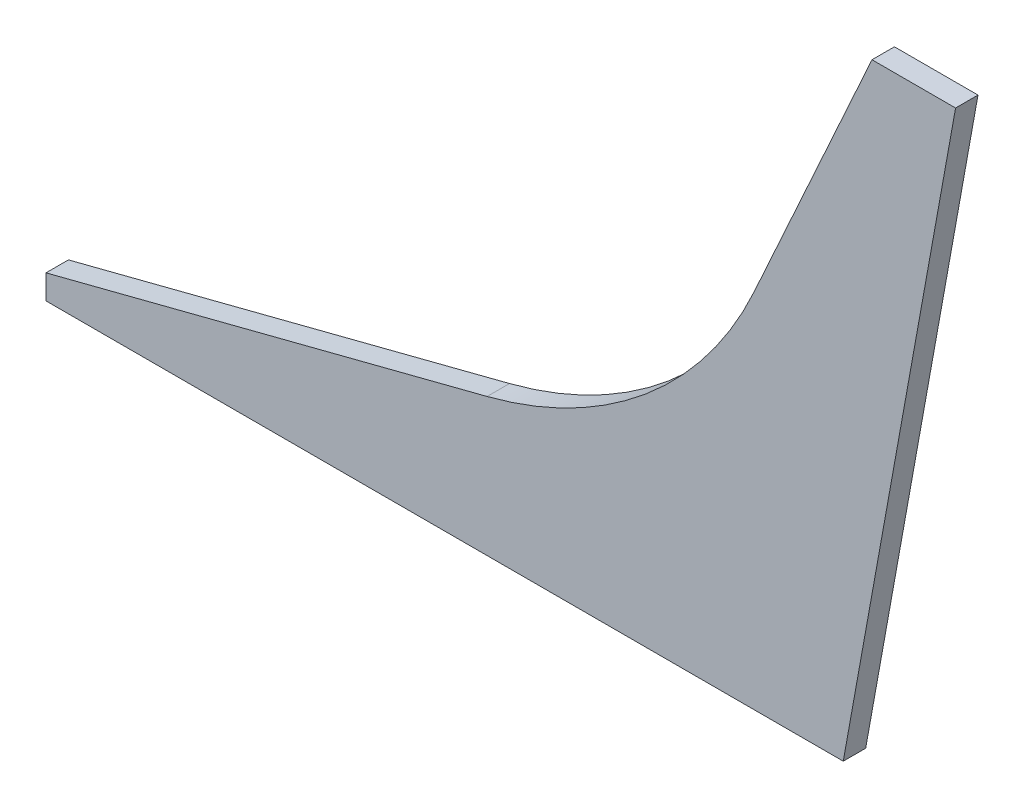
from build123d import *

# Parameters (mm, degrees)
BOSS_EXTRUDE1_DEPTH     = 15
CUT_EXTRUDE1_DEPTH      = 576.044354215
CUT_EXTRUDE1_DEPTH_BACK = 576.044354215
SCALE1_SCALE            = 0.6


with BuildPart() as part:
    # Sketch1 → Boss-Extrude1 (new body)
    with BuildSketch(Plane.XY):
        with BuildLine():
            Line((-236.729376996, 0), (0, 0))
            Line((0, 0), (357.876847169, 0))
            Line((357.876847169, 0), (396.730398779, 416))
            Line((396.730398779, 416), (315.832809595, 416))
            Line((315.832809595, 416), (236.983089551, 242.144494596))
            ThreePointArc((236.983089551, 242.144494596), (164.696190822, 146.877858304), (58.352308735, 92.177707838))
            Line((58.352308735, 92.177707838), (-236.729376996, 16.274880501))
            Line((-236.729376996, 16.274880501), (-236.729376996, 0))
        make_face()
    extrude(amount=BOSS_EXTRUDE1_DEPTH)

    # Sketch2 → Cut-Extrude1 (cut, two sides: drawn at the far end of the back side and taken through both)
    with BuildSketch(Plane.XY.offset(15).offset(-CUT_EXTRUDE1_DEPTH_BACK)):
        Polygon((396.730398779, 416), (357.876847169, 0), (296.597151769, 0), (371.734942748, 416), align=None)
    extrude(amount=CUT_EXTRUDE1_DEPTH + CUT_EXTRUDE1_DEPTH_BACK, mode=Mode.SUBTRACT)


with BuildPart() as part_1:
    # Scale1: scaled about (174.395350586, 126.79859987, 7.5)
    add(part.part.scale(SCALE1_SCALE).moved(Location((69.758140234, 50.719439948, 3))))


solid = part_1.part
